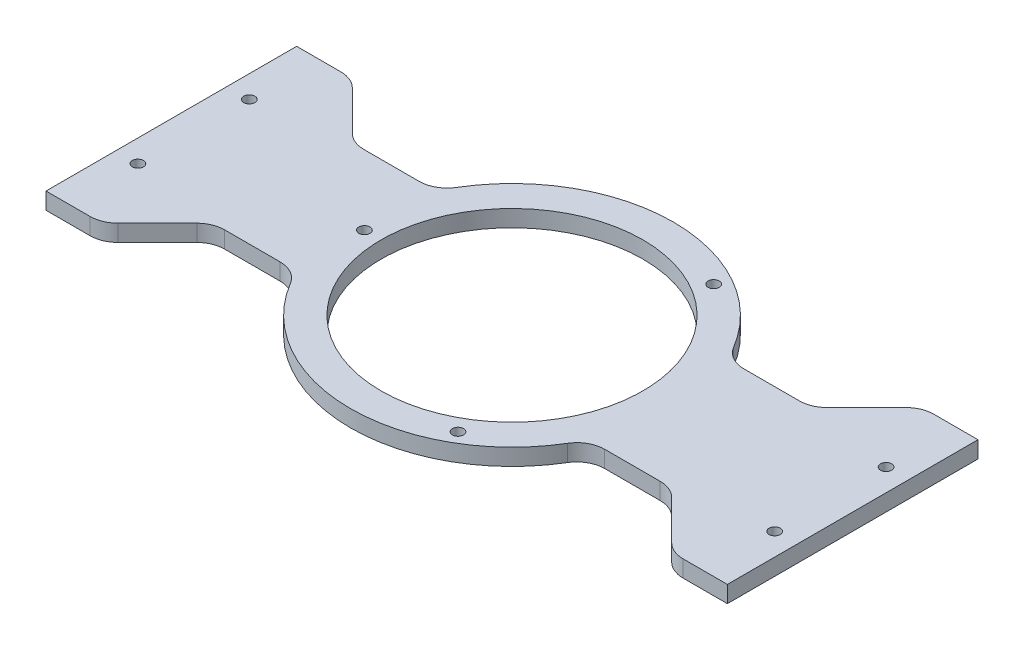
from build123d import *

# Parameters (mm, degrees)
SKETCH2_R            = 29
SKETCH2_R_2          = 23.5
BOSS_EXTRUDE1_DEPTH  = 3
SKETCH2_3_R          = 1
BOSS_EXTRUDE2_DEPTH  = 3
FILLET1_R            = 5
SKETCH3_R            = 1
CUT_EXTRUDE1_DEPTH   = 3
CIRPATTERN1_COUNT    = 3
FILLET1_OF_MIRROR1_R = 5


with BuildPart() as part:
    # Sketch2 → Boss-Extrude1 (new body)
    with BuildSketch(Plane(origin=(0, 0, 0), x_dir=(1, 0, 0), z_dir=(0, 1, 0))):
        with Locations(Location((0, 0, 0), (0, 0, 270))):
            Circle(SKETCH2_R)
        with Locations(Location((0, 0, 0), (0, 0, 270))):
            Circle(SKETCH2_R_2, mode=Mode.SUBTRACT)
    extrude(amount=BOSS_EXTRUDE1_DEPTH)

    # Sketch2<3> → Boss-Extrude2 (add)
    with BuildSketch(Plane(origin=(0, 0, 0), x_dir=(1, 0, 0), z_dir=(0, 1, 0))):
        with BuildLine():
            Line((41.167728216, 12.5), (26.167728216, 12.5))
            ThreePointArc((26.167728216, 12.5), (28.283070186, 6.408427332), (29, 0))
            ThreePointArc((29, 0), (28.283070186, -6.408427332), (26.167728216, -12.5))
            Line((26.167728216, -12.5), (41.167728216, -12.5))
            Line((41.167728216, -12.5), (51.167728216, -22.5))
            Line((51.167728216, -22.5), (61.167728216, -22.5))
            Line((61.167728216, -22.5), (61.167728216, 22.5))
            Line((61.167728216, 22.5), (51.167728216, 22.5))
            Line((51.167728216, 22.5), (41.167728216, 12.5))
        make_face()
        with Locations(Location((57.167728216, -10, 0), (0, 0, 270))):
            Circle(SKETCH2_3_R, mode=Mode.SUBTRACT)
        with Locations(Location((57.167728216, 10, 0), (0, 0, 270))):
            Circle(SKETCH2_3_R, mode=Mode.SUBTRACT)
    boss_extrude2 = extrude(amount=BOSS_EXTRUDE2_DEPTH)

    # Fillet1
    fillet1_edges = [part.edges().sort_by_distance(p)[0] for p in [
        (41.167728216, 1.5, -12.5),
        (51.167728216, 1.5, -22.5),
        (51.167728216, 1.5, 22.5),
        (41.167728216, 1.5, 12.5),
        (26.167728216, 1.5, 12.5),
        (26.167728216, 1.5, -12.5),
    ]]
    fillet(fillet1_edges, radius=FILLET1_R)

    # Sketch3 → Cut-Extrude1 (cut)
    with BuildSketch(Plane(origin=(0, 3, 0), x_dir=(1, 0, 0), z_dir=(0, 1, 0))):
        with Locations(Location((13.25, 22.9496732, 0), (0, 0, 270))):
            Circle(SKETCH3_R)
    cut_extrude1 = extrude(amount=-CUT_EXTRUDE1_DEPTH, mode=Mode.SUBTRACT)

    # CirPattern1: Cut-Extrude1 ×3 about axis
    cirpattern1_axis = Axis((0, 0, 0), (0, 1, 0))
    for i in range(1, CIRPATTERN1_COUNT):
        add(cut_extrude1.rotate(cirpattern1_axis, i * 360 / CIRPATTERN1_COUNT), mode=Mode.SUBTRACT)

    # Mirror1: Boss-Extrude2 across plane
    add(boss_extrude2.mirror(Plane(origin=(0, 0, 0), x_dir=(0, 0, 1), z_dir=(1, 0, 0))))

    # Fillet1 of Mirror1
    fillet1_of_mirror1_edges = [part.edges().sort_by_distance(p)[0] for p in [
        (-41.167728216, 1.5, -12.5),
        (-51.167728216, 1.5, -22.5),
        (-51.167728216, 1.5, 22.5),
        (-41.167728216, 1.5, 12.5),
        (-26.167728216, 1.5, 12.5),
        (-26.167728216, 1.5, -12.5),
    ]]
    fillet(fillet1_of_mirror1_edges, radius=FILLET1_OF_MIRROR1_R)


solid = part.part
